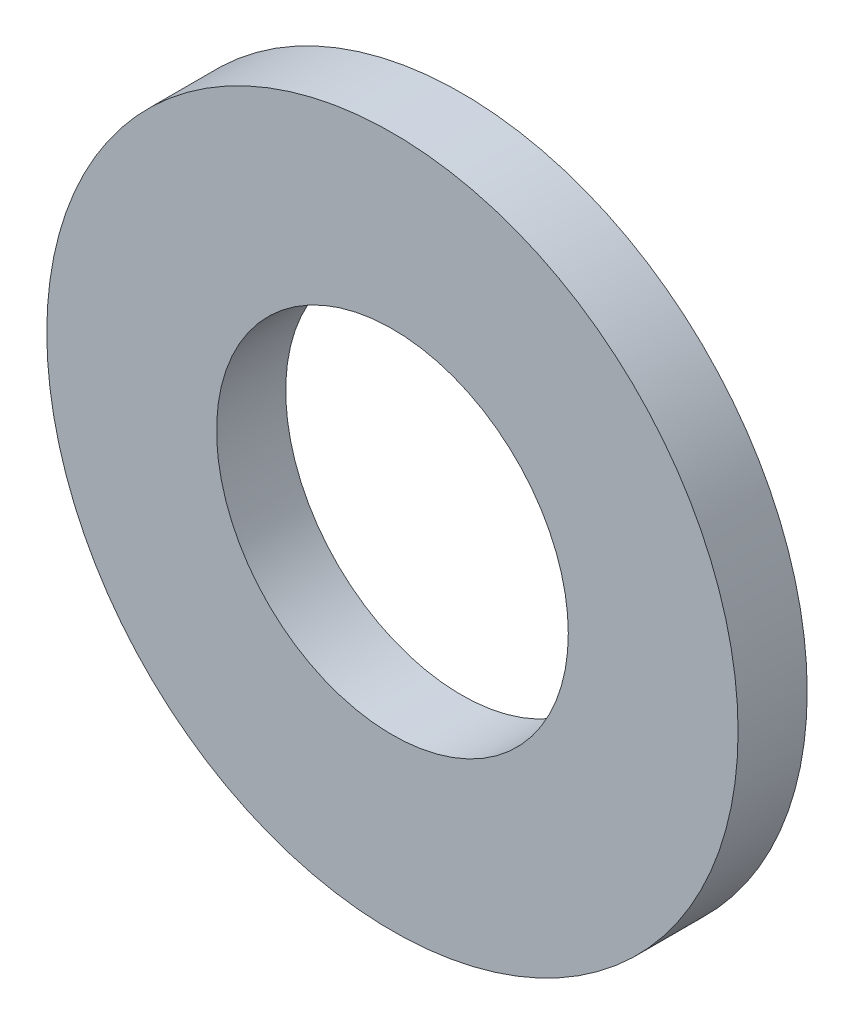
from build123d import *

# Parameters (mm, degrees)
SKETCH1_R           = 7.9375
SKETCH1_R_2         = 4.0386
BOSS_EXTRUDE1_DEPTH = 1.5875


with BuildPart() as part:
    # Sketch1 → Boss-Extrude1 (new body)
    with BuildSketch(Plane.XY):
        Circle(SKETCH1_R)
        Circle(SKETCH1_R_2, mode=Mode.SUBTRACT)
    extrude(amount=BOSS_EXTRUDE1_DEPTH)


solid = part.part
